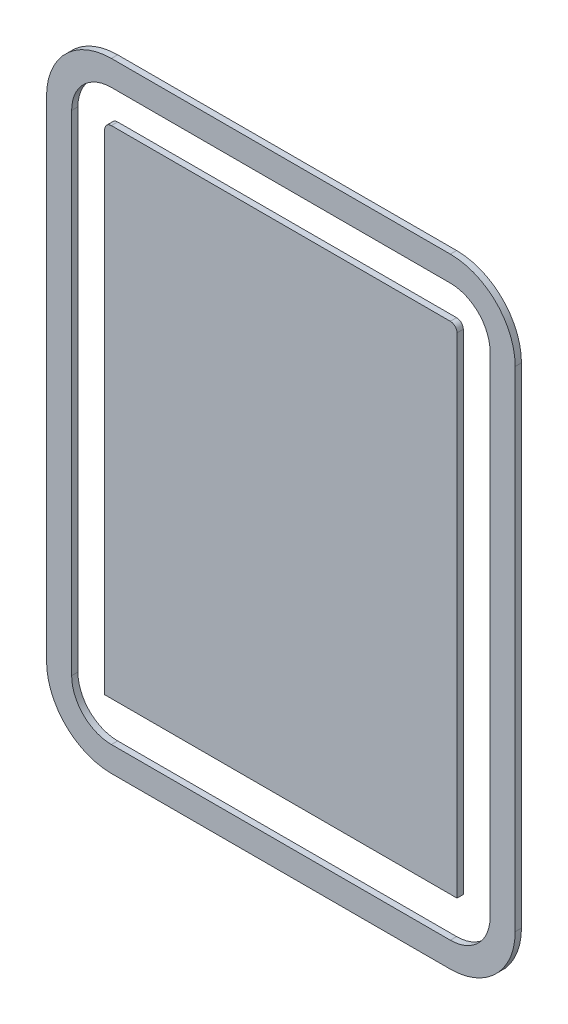
from build123d import *

# Parameters (mm, degrees)
BOSS_EXTRUDE1_DEPTH   = 1.5
BOSS_EXTRUDE1_2_DEPTH = 1.5


with BuildPart() as part:
    # Sketch1 → Boss-Extrude1 (new body)
    with BuildSketch(Plane.XY):
        with BuildLine():
            Line((-61.52326721, -81.529096158), (22.67673279, -81.529096158))
            Line((22.67673279, -81.529096158), (22.67673279, 35.470903842))
            ThreePointArc((22.67673279, 35.470903842), (22.20810364, 36.602274691), (21.07673279, 37.070903842))
            Line((21.07673279, 37.070903842), (-59.92326721, 37.070903842))
            ThreePointArc((-59.92326721, 37.070903842), (-61.054638059, 36.602274691), (-61.52326721, 35.470903842))
            Line((-61.52326721, 35.470903842), (-61.52326721, -81.529096158))
        make_face()
    extrude(amount=BOSS_EXTRUDE1_DEPTH)


with BuildPart() as body_2:
    # Sketch1 → Boss-Extrude1 2 (new body)
    with BuildSketch(Plane.XY):
        with BuildLine():
            Line((-59.92326721, -97.029096158), (21.07673279, -97.029096158))
            ThreePointArc((21.07673279, -97.029096158), (32.036887899, -92.489251267), (36.57673279, -81.529096158))
            Line((36.57673279, -81.529096158), (36.57673279, 35.470903842))
            ThreePointArc((36.57673279, 35.470903842), (32.036887899, 46.43105895), (21.07673279, 50.970903842))
            Line((21.07673279, 50.970903842), (-59.92326721, 50.970903842))
            ThreePointArc((-59.92326721, 50.970903842), (-70.883422318, 46.43105895), (-75.42326721, 35.470903842))
            Line((-75.42326721, 35.470903842), (-75.42326721, -81.529096158))
            ThreePointArc((-75.42326721, -81.529096158), (-70.883422318, -92.489251267), (-59.92326721, -97.029096158))
        make_face()
        with BuildLine():
            Line((30.57673279, -81.529096158), (30.57673279, 35.470903842))
            ThreePointArc((30.57673279, 35.470903842), (27.794247212, 42.188418263), (21.07673279, 44.970903842))
            Line((21.07673279, 44.970903842), (-59.92326721, 44.970903842))
            ThreePointArc((-59.92326721, 44.970903842), (-66.640781631, 42.188418263), (-69.42326721, 35.470903842))
            Line((-69.42326721, 35.470903842), (-69.42326721, -81.529096158))
            ThreePointArc((-69.42326721, -81.529096158), (-66.640781631, -88.24661058), (-59.92326721, -91.029096158))
            Line((-59.92326721, -91.029096158), (21.07673279, -91.029096158))
            ThreePointArc((21.07673279, -91.029096158), (27.794247212, -88.24661058), (30.57673279, -81.529096158))
        make_face(mode=Mode.SUBTRACT)
    extrude(amount=BOSS_EXTRUDE1_2_DEPTH)


solid = Compound([part.part, body_2.part])
